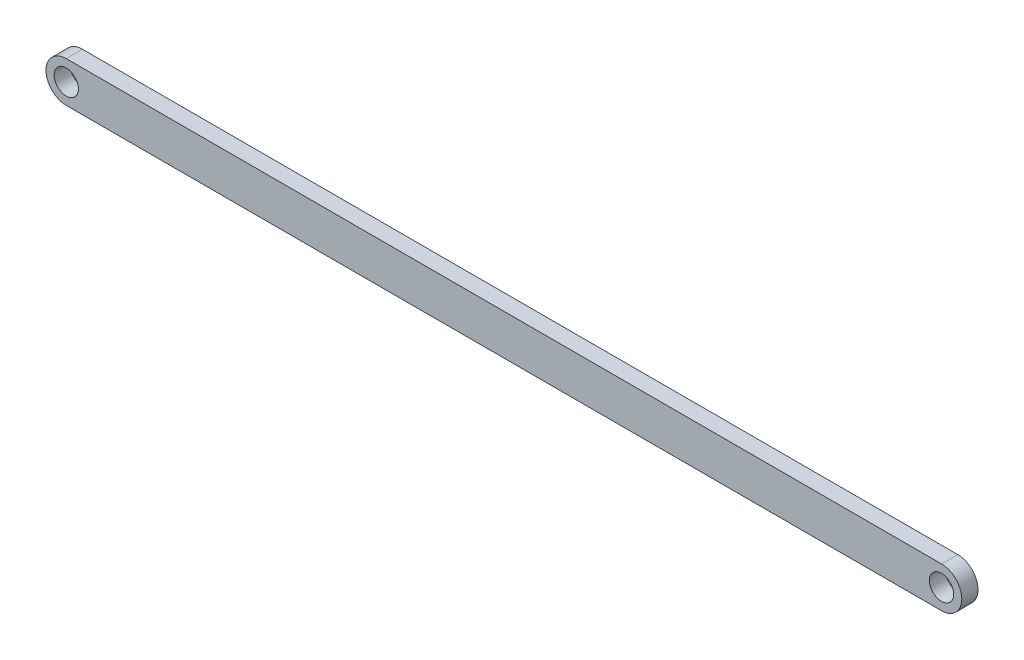
from build123d import *

# Parameters (mm, degrees)
ESBO_O1_R                = 1.5
RESSALTO_EXTRUS_O1_DEPTH = 2


with BuildPart() as part:
    # Esboço1 → Ressalto-extrusão1 (new body)
    with BuildSketch(Plane.XY):
        with BuildLine():
            Line((0, 2.5), (108, 2.5))
            ThreePointArc((108, 2.5), (110.5, 0), (108, -2.5))
            Line((108, -2.5), (0, -2.5))
            ThreePointArc((0, -2.5), (-2.5, 0), (0, 2.5))
        make_face()
        Circle(ESBO_O1_R, mode=Mode.SUBTRACT)
        with Locations((108, 0)):
            Circle(ESBO_O1_R, mode=Mode.SUBTRACT)
    extrude(amount=RESSALTO_EXTRUS_O1_DEPTH)


solid = part.part
